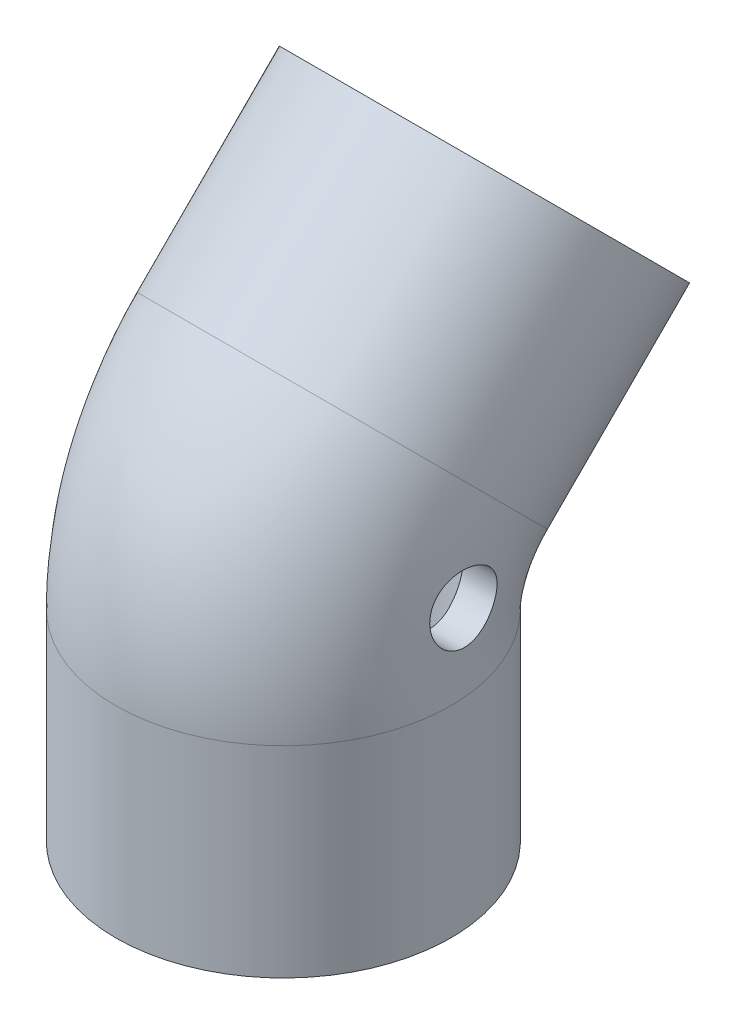
from build123d import *

# Parameters (mm, degrees)
ESBO_O4_R                  = 12.5
ESBO_O4_R_2                = 10
CORTE_EXTRUS_O1_DEPTH      = 20
CORTE_EXTRUS_O1_DEPTH_BACK = 20
ESBO_O5_R                  = 2.5


with BuildPart() as part:
    # Varredura1: sweep along a path in Esboço3
    with BuildLine(Plane(origin=(0, 0, 0), x_dir=(0, 0, -1), z_dir=(1, 0, 0))) as varredura1_path:
        Line((0, 0), (0, 15))
        ThreePointArc((0, 15), (1.141807012, 20.740251485), (4.393398282, 25.606601718))
        Line((4.393398282, 25.606601718), (15, 36.213203436))
    # Esboço4 → Varredura1 (sweep)
    with BuildSketch(Plane(origin=(0, 0, 0), x_dir=(1, 0, 0), z_dir=(0, 1, 0))):
        Circle(ESBO_O4_R)
        Circle(ESBO_O4_R_2, mode=Mode.SUBTRACT)
    sweep(path=varredura1_path.line)

    # Esboço5 → Corte-extrusão1 (cut, two sides: drawn at the far end of the back side and taken through both)
    with BuildSketch(Plane(origin=(0, 0, 0), x_dir=(0, 0, -1), z_dir=(1, 0, 0)).offset(-CORTE_EXTRUS_O1_DEPTH_BACK)):
        with Locations((1.141807012, 20.740251485)):
            Circle(ESBO_O5_R)
    extrude(amount=CORTE_EXTRUS_O1_DEPTH + CORTE_EXTRUS_O1_DEPTH_BACK, mode=Mode.SUBTRACT)


solid = part.part
